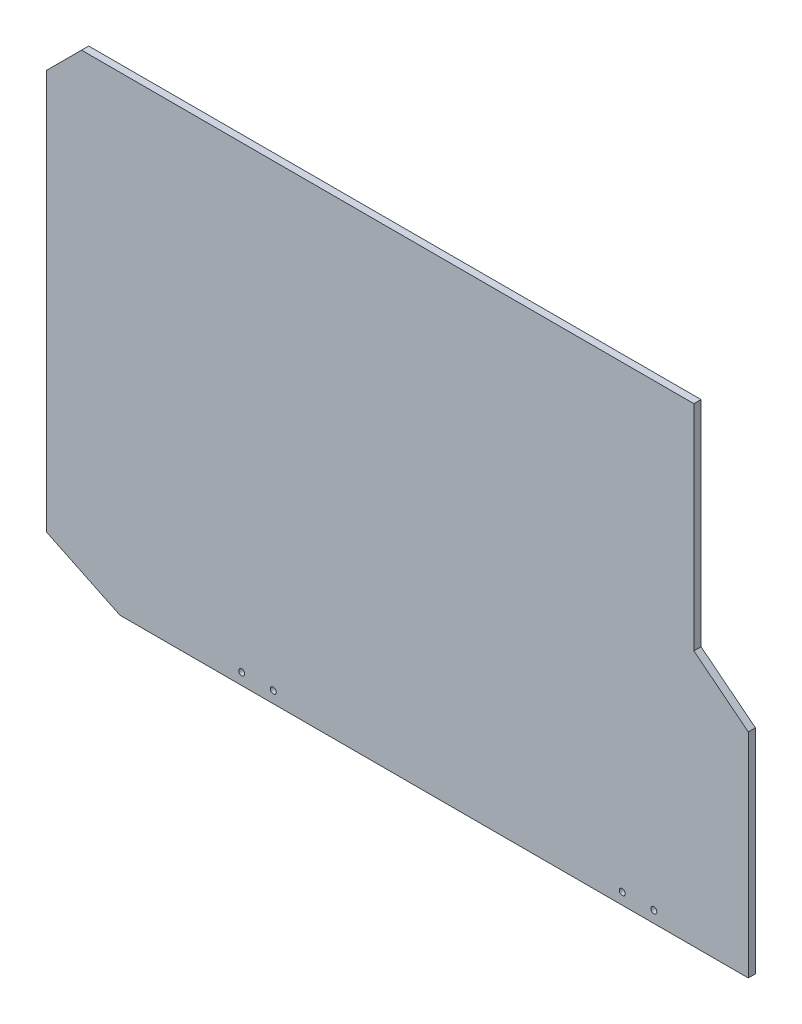
from build123d import *

# Parameters (mm, degrees)
BOSS_EXTRU_1_DEPTH      = 5
ESQUISSE3_R             = 2.1
ENL_V_MAT_EXTRU_2_DEPTH = 580.22097683


with BuildPart() as part:
    # Esquisse1 → Boss.-Extru.1 (new body)
    with BuildSketch(Plane.XY):
        Polygon((-29.5, 326.885786438), (-29.5, 47.628797826), (21.727899478, 23), (460.5, 23), (460.5, 171.815398059), (422.5, 201.815398059), (422.5, 351.3), (-5.085786438, 351.3), align=None)
    extrude(amount=-BOSS_EXTRU_1_DEPTH)

    # Esquisse3 → Enlèv. mat.-Extru.2 (cut, through all)
    with BuildSketch(Plane.XY):
        with Locations((106.8, 31)):
            Circle(ESQUISSE3_R)
        with Locations((128.8, 31)):
            Circle(ESQUISSE3_R)
        with Locations((372.5, 31)):
            Circle(ESQUISSE3_R)
        with Locations((394.5, 31)):
            Circle(ESQUISSE3_R)
    extrude(amount=-ENL_V_MAT_EXTRU_2_DEPTH, mode=Mode.SUBTRACT)


solid = part.part
